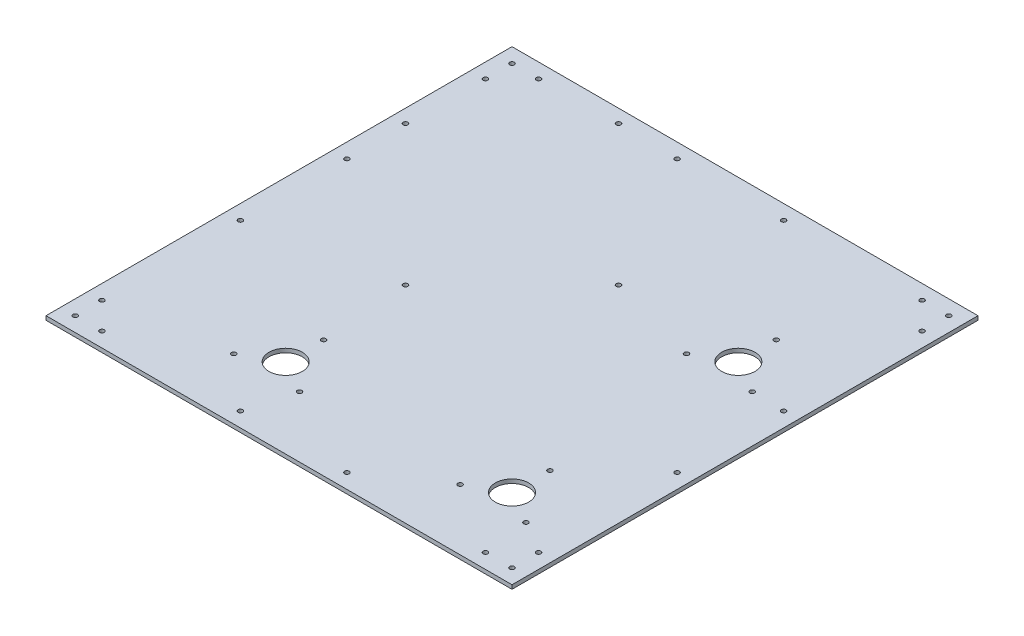
from build123d import *

# Parameters (mm, degrees)
SKETCH_1_W               = 350
SKETCH_1_H               = 350
EXTRUDE_302_DEPTH        = 3
CUT_EXTRUDE_1_DEPTH      = 248.505555493
CUT_EXTRUDE_1_DEPTH_BACK = 248.505555493
SKETCH_2_R               = 1.75
SKETCH_2_R_2             = 12.5
SKETCH_3_R               = 1.75
PVC_DEPTH                = 248.505555493


with BuildPart() as part:
    # 草图1 → Extrude 302 (new body)
    with BuildSketch(Plane(origin=(0, 0, 0), x_dir=(1, 0, 0), z_dir=(0, 1, 0))):
        Rectangle(SKETCH_1_W, SKETCH_1_H)
    extrude(amount=EXTRUDE_302_DEPTH)

    # 草图2 → 切除-拉伸1 (cut, two sides: drawn at the far end of the back side and taken through both)
    with BuildSketch(Plane(origin=(0, 3, 0), x_dir=(1, 0, 0), z_dir=(0, 1, 0)).offset(-CUT_EXTRUDE_1_DEPTH_BACK)):
        with Locations(Location((20.060966544, 59.939033456, 0), (0, 0, 270))):
            Circle(SKETCH_2_R)
        with Locations(Location((-59.939033456, -20.060966544, 0), (0, 0, 270))):
            Circle(SKETCH_2_R)
        with Locations(Location((-165, 85, 0), (0, 0, 270))):
            Circle(SKETCH_2_R)
        with Locations(Location((-85, 165, 0), (0, 0, 270))):
            Circle(SKETCH_2_R)
        with Locations(Location((-55, -115, 0), (0, 0, 270))):
            Circle(SKETCH_2_R_2)
        with Locations(Location((115, -115, 0), (0, 0, 270))):
            Circle(SKETCH_2_R_2)
        with Locations(Location((115, 55, 0), (0, 0, 270))):
            Circle(SKETCH_2_R_2)
        with Locations(Location((-55, -86.5, 0), (0, 0, 270))):
            Circle(SKETCH_2_R)
        with Locations(Location((115, -86.5, 0), (0, 0, 270))):
            Circle(SKETCH_2_R)
        with Locations(Location((115, 83.5, 0), (0, 0, 270))):
            Circle(SKETCH_2_R)
        with Locations(Location((139.681724008, 40.75, 0), (0, 0, 270))):
            Circle(SKETCH_2_R)
        with Locations(Location((90.318275992, 40.75, 0), (0, 0, 270))):
            Circle(SKETCH_2_R)
        with Locations(Location((-30.318275992, -129.25, 0), (0, 0, 270))):
            Circle(SKETCH_2_R)
        with Locations(Location((-79.681724008, -129.25, 0), (0, 0, 270))):
            Circle(SKETCH_2_R)
        with Locations(Location((139.681724008, -129.25, 0), (0, 0, 270))):
            Circle(SKETCH_2_R)
        with Locations(Location((90.318275992, -129.25, 0), (0, 0, 270))):
            Circle(SKETCH_2_R)
    extrude(amount=CUT_EXTRUDE_1_DEPTH + CUT_EXTRUDE_1_DEPTH_BACK, mode=Mode.SUBTRACT)

    # 草图3 → PVC安装 (cut, through all)
    with BuildSketch(Plane(origin=(0, 3, 0), x_dir=(1, 0, 0), z_dir=(0, 1, 0))):
        with Locations(Location((-164, 144, 0), (0, 0, 270))):
            Circle(SKETCH_3_R)
        with Locations(Location((-164, 164, 0), (0, 0, 270))):
            Circle(SKETCH_3_R)
        with Locations(Location((-144, 164, 0), (0, 0, 270))):
            Circle(SKETCH_3_R)
        with Locations(Location((164, 164, 0), (0, 0, 270))):
            Circle(SKETCH_3_R)
        with Locations(Location((144, 164, 0), (0, 0, 270))):
            Circle(SKETCH_3_R)
        with Locations(Location((164, 144, 0), (0, 0, 270))):
            Circle(SKETCH_3_R)
        with Locations(Location((164, -164, 0), (0, 0, 270))):
            Circle(SKETCH_3_R)
        with Locations(Location((164, -144, 0), (0, 0, 270))):
            Circle(SKETCH_3_R)
        with Locations(Location((144, -164, 0), (0, 0, 270))):
            Circle(SKETCH_3_R)
        with Locations(Location((-164, -164, 0), (0, 0, 270))):
            Circle(SKETCH_3_R)
        with Locations(Location((-144, -164, 0), (0, 0, 270))):
            Circle(SKETCH_3_R)
        with Locations(Location((-164, -144, 0), (0, 0, 270))):
            Circle(SKETCH_3_R)
        with Locations(Location((-164, 40, 0), (0, 0, 270))):
            Circle(SKETCH_3_R)
        with Locations(Location((-164, -40, 0), (0, 0, 270))):
            Circle(SKETCH_3_R)
        with Locations(Location((40, 164, 0), (0, 0, 270))):
            Circle(SKETCH_3_R)
        with Locations(Location((-40, 164, 0), (0, 0, 270))):
            Circle(SKETCH_3_R)
        with Locations(Location((164, -40, 0), (0, 0, 270))):
            Circle(SKETCH_3_R)
        with Locations(Location((164, 40, 0), (0, 0, 270))):
            Circle(SKETCH_3_R)
        with Locations(Location((-40, -164, 0), (0, 0, 270))):
            Circle(SKETCH_3_R)
        with Locations(Location((40, -164, 0), (0, 0, 270))):
            Circle(SKETCH_3_R)
    extrude(amount=-PVC_DEPTH, mode=Mode.SUBTRACT)


solid = part.part
